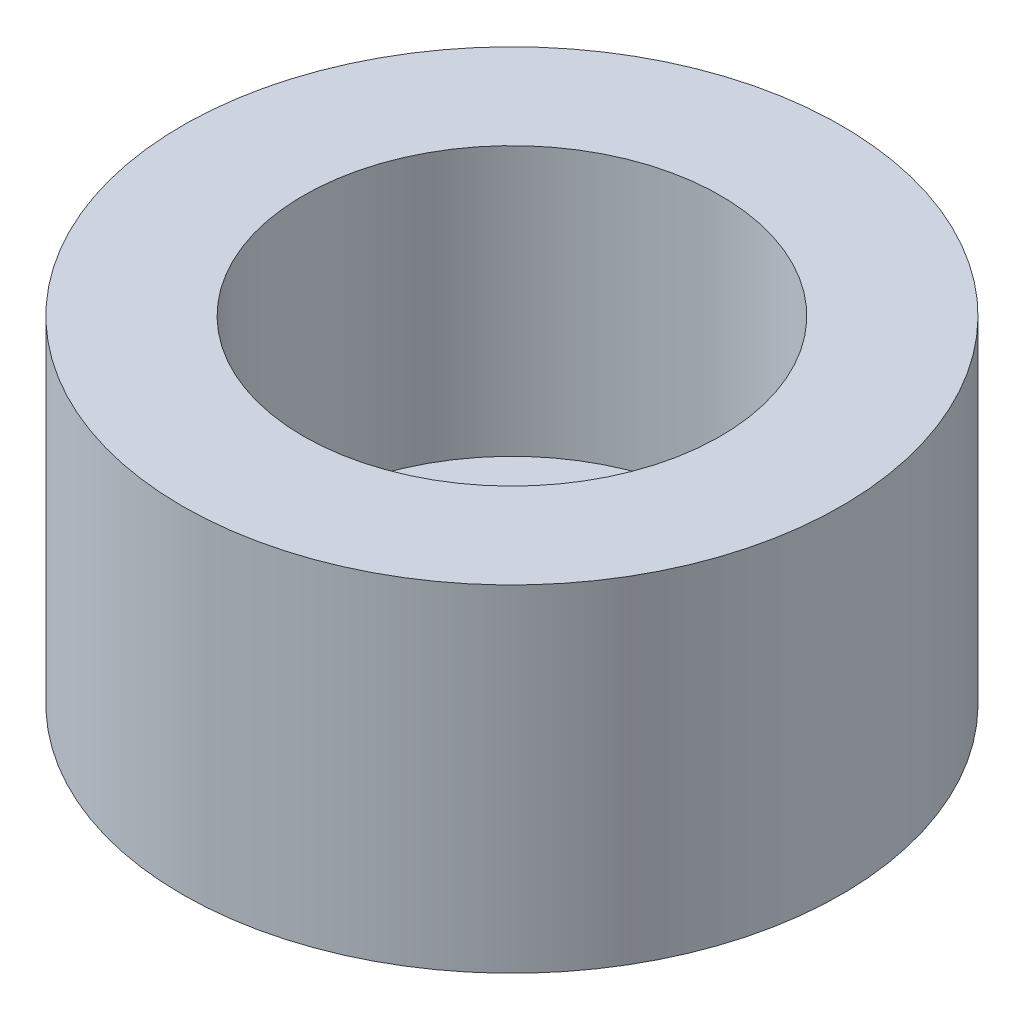
from build123d import *

# Parameters (mm, degrees)
SKETCH1_R           = 2.45
BOSS_EXTRUDE1_DEPTH = 2.5
SKETCH2_R           = 1.55
CUT_EXTRUDE1_DEPTH  = 2


with BuildPart() as part:
    # Sketch1 → Boss-Extrude1 (new body)
    with BuildSketch(Plane(origin=(0, 0, 0), x_dir=(1, 0, 0), z_dir=(0, 1, 0))):
        with Locations(Location((0, 0, 0), (0, 0, 270))):
            Circle(SKETCH1_R)
    extrude(amount=BOSS_EXTRUDE1_DEPTH)

    # Sketch2 → Cut-Extrude1 (cut)
    with BuildSketch(Plane(origin=(0, 2.5, 0), x_dir=(1, 0, 0), z_dir=(0, 1, 0))):
        with Locations(Location((0, 0, 0), (0, 0, 270))):
            Circle(SKETCH2_R)
    extrude(amount=-CUT_EXTRUDE1_DEPTH, mode=Mode.SUBTRACT)


solid = part.part
